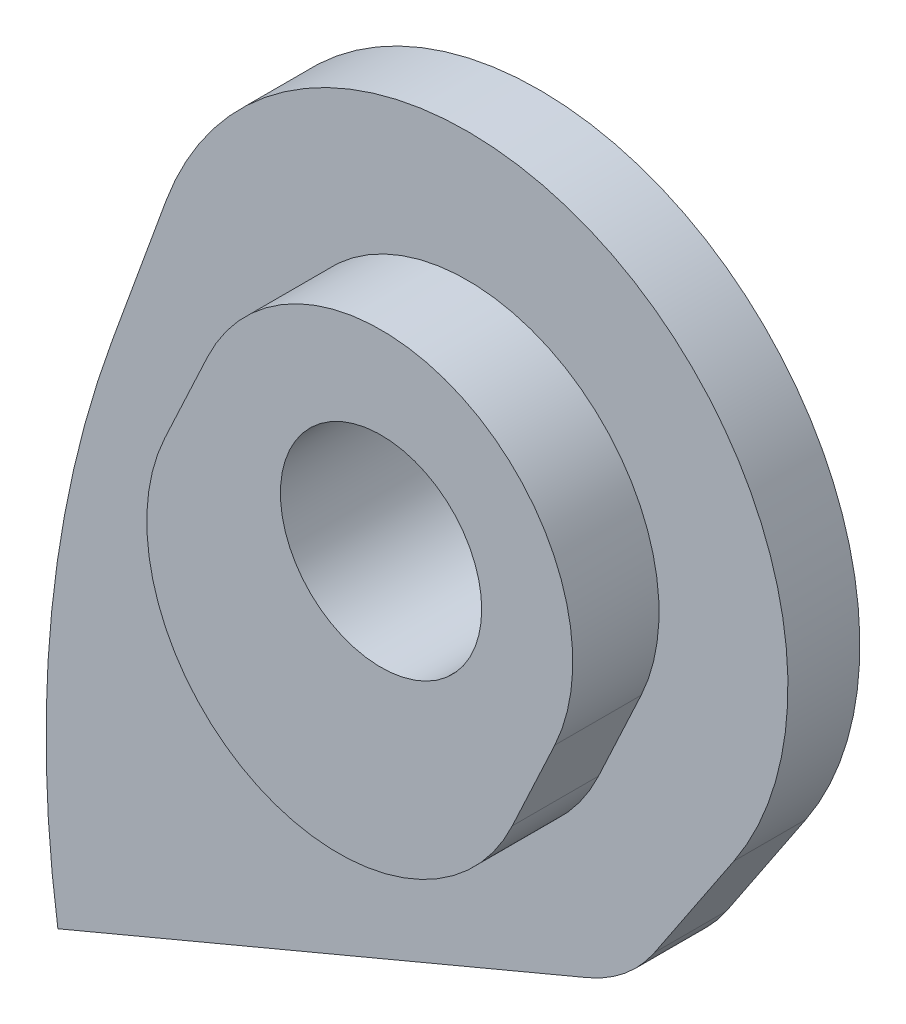
from build123d import *
from build123d.topology import SkipClean

# Parameters (mm, degrees)
SKETCH3_R           = 2.75
SKETCH3_R_2         = 2.1
BOSS_EXTRUDE2_DEPTH = 11
BOSS_EXTRUDE4_START = 1.5
BOSS_EXTRUDE4_DEPTH = 1.5
BOSS_EXTRUDE3_START = 3
BOSS_EXTRUDE3_DEPTH = 3
SKETCH14_W          = 47.285712055
SKETCH14_H          = 12.595473758
CUT_EXTRUDE1_DEPTH  = 92.326119258
BOSS_EXTRUDE5_DEPTH = 1.8
SKETCH15_R          = 2.1
CUT_EXTRUDE2_DEPTH  = 88.481943873


with BuildPart() as part:
    # Sketch3 → Boss-Extrude2 (new body)
    with BuildSketch(Plane.XY):
        with BuildLine():
            Line((11.81639044, 60.252883085), (11.728372068, 60.311638564))
            ThreePointArc((11.728372068, 60.311638564), (8.917204522, 62.7925154), (6.866230988, 65.931132995))
            ThreePointArc((6.866230988, 65.931132995), (6.025591445, 67.274340702), (4.901176311, 68.390840765))
            ThreePointArc((4.901176311, 68.390840765), (3.375934297, 70.989881123), (4.020351516, 73.93370524))
            Line((4.020351516, 73.93370524), (5.678869184, 76.41823992))
            ThreePointArc((5.678869184, 76.41823992), (3.137547336, 86.100651278), (-6.171856019, 82.420649156))
            Line((-6.171856019, 82.420649156), (-7.290261888, 79.347854286))
            ThreePointArc((-7.290261888, 79.347854286), (-8.557893098, 69.185727028), (-5.279809822, 59.483671095))
            ThreePointArc((-5.279809822, 59.483671095), (-2.848156457, 57.139360441), (0.414833066, 56.266646336))
            ThreePointArc((0.414833066, 56.266646336), (3.287818882, 55.822166382), (5.91364728, 54.574514525))
            Line((5.91364728, 54.574514525), (7.374782695, 53.599153256))
            ThreePointArc((7.374782695, 53.599153256), (10.815902262, 50.678650143), (13.499590609, 47.049812979))
            ThreePointArc((13.499590609, 47.049812979), (24.965953819, 46.665736496), (20.21385057, 57.108078892))
            ThreePointArc((20.21385057, 57.108078892), (15.833272198, 58.194897845), (11.81639044, 60.252883085))
        make_face()
        with Locations((19.351869275, 50.413343031)):
            Circle(SKETCH3_R, mode=Mode.SUBTRACT)
        with Locations((0.471910886, 63.016405008)):
            Circle(SKETCH3_R, mode=Mode.SUBTRACT)
        with Locations((0.114687614, 80.132534397)):
            Circle(SKETCH3_R_2, mode=Mode.SUBTRACT)
    extrude(amount=BOSS_EXTRUDE2_DEPTH)

    # Sketch13 → Boss-Extrude4 (add)
    with SkipClean():  # the faces are left unmerged after this step: merging them gives an invalid solid
        with BuildSketch(Plane(origin=(0, 0, 0), x_dir=(-1, 0, 0), z_dir=(0, 0, -1)).offset(BOSS_EXTRUDE4_START)):
            with BuildLine():
                Line((-5.678869184, 76.41823992), (-4.020351516, 73.93370524))
                ThreePointArc((-4.020351516, 73.93370524), (-3.407782277, 73.255690271), (-2.625844204, 72.782913134))
                Line((-2.625844204, 72.782913134), (8.427696777, 68.139691908))
                ThreePointArc((8.427696777, 68.139691908), (8.557268078, 73.814637343), (7.290261888, 79.347854286))
                Line((7.290261888, 79.347854286), (6.171856019, 82.420649156))
                ThreePointArc((6.171856019, 82.420649156), (-3.137547336, 86.100651278), (-5.678869184, 76.41823992))
            make_face()
        extrude(amount=-BOSS_EXTRUDE4_DEPTH)

    # Sketch12 → Boss-Extrude3 (add)
    with SkipClean():  # the faces are left unmerged after this step: merging them gives an invalid solid
        with BuildSketch(Plane(origin=(0, 0, -1.5), x_dir=(-1, 0, 0), z_dir=(0, 0, -1)).offset(BOSS_EXTRUDE3_START)):
            with BuildLine():
                Line((8.013597957, 76.965805827), (4.924247842, 69.611373108))
                Line((4.924247842, 69.611373108), (8.427696777, 68.139691908))
                ThreePointArc((8.427696777, 68.139691908), (8.649339764, 72.572862025), (8.013597957, 76.965805827))
            make_face()
        extrude(amount=-BOSS_EXTRUDE3_DEPTH)

    # Sketch14 → Cut-Extrude1 (cut, through all)
    with BuildSketch(Plane(origin=(0, 0, 0), x_dir=(1, 0, 0), z_dir=(0, 1, 0))):
        with Locations((8.412006537, -6.297736879)):
            Rectangle(SKETCH14_W, SKETCH14_H)
    extrude(amount=CUT_EXTRUDE1_DEPTH, mode=Mode.SUBTRACT)

    # Sketch16 → Boss-Extrude5 (add)
    with BuildSketch(Plane.XY):
        with BuildLine():
            Line((3.739918762, 78.44206135), (2.852420412, 76.538814997))
            ThreePointArc((2.852420412, 76.538814997), (-2.463283783, 74.604056896), (-4.398041884, 79.919761091))
            Line((-4.398041884, 79.919761091), (-3.510543534, 81.823007444))
            ThreePointArc((-3.510543534, 81.823007444), (1.805160661, 83.757765545), (3.739918762, 78.44206135))
        make_face()
    extrude(amount=BOSS_EXTRUDE5_DEPTH)

    # Sketch15 → Cut-Extrude2 (cut, through all)
    with BuildSketch(Plane.XY.offset(1.8)):
        with Locations((0.114687614, 80.132534397)):
            Circle(SKETCH15_R)
    extrude(amount=-CUT_EXTRUDE2_DEPTH, mode=Mode.SUBTRACT)


solid = part.part
